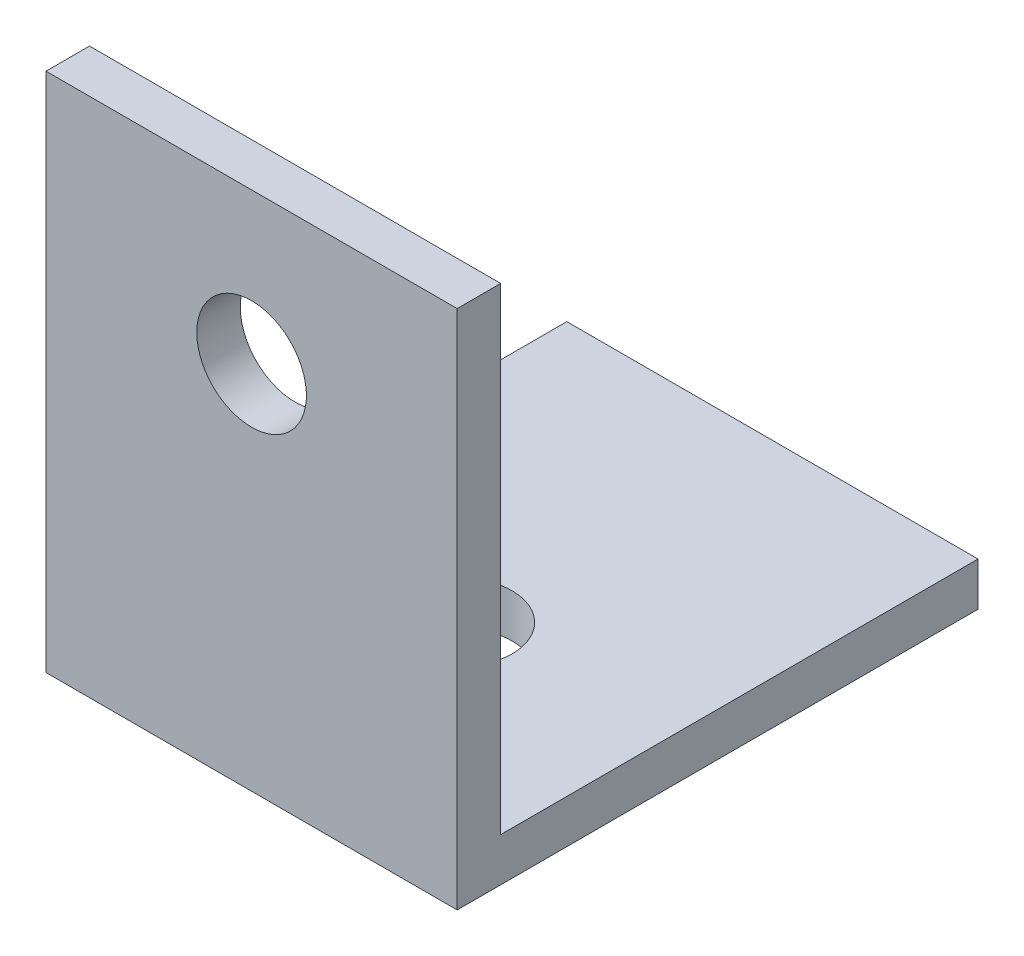
from build123d import *

# Parameters (mm, degrees)
SKETCH1_W           = 30
SKETCH1_H           = 38
BOSS_EXTRUDE1_DEPTH = 3.175
SKETCH2_W           = 30
SKETCH2_H           = 3.175
BOSS_EXTRUDE2_DEPTH = 34.825
SKETCH3_R           = 4
CUT_EXTRUDE1_DEPTH  = 60.638751035
SKETCH4_R           = 4
CUT_EXTRUDE2_DEPTH  = 58.667679423


with BuildPart() as part:
    # Sketch1 → Boss-Extrude1 (new body)
    with BuildSketch(Plane.XY):
        with Locations((15, 19)):
            Rectangle(SKETCH1_W, SKETCH1_H)
    extrude(amount=BOSS_EXTRUDE1_DEPTH)

    # Sketch2 → Boss-Extrude2 (add)
    with BuildSketch(Plane(origin=(0, 0, 0), x_dir=(-1, 0, 0), z_dir=(0, 0, -1))):
        with Locations((-15, 1.5875)):
            Rectangle(SKETCH2_W, SKETCH2_H)
    extrude(amount=BOSS_EXTRUDE2_DEPTH)

    # Sketch3 → Cut-Extrude1 (cut, through all)
    with BuildSketch(Plane(origin=(0, 0, 0), x_dir=(-1, 0, 0), z_dir=(0, 0, -1))):
        with Locations((-15, 27)):
            Circle(SKETCH3_R)
    extrude(amount=-CUT_EXTRUDE1_DEPTH, mode=Mode.SUBTRACT)

    # Sketch4 → Cut-Extrude2 (cut, through all)
    with BuildSketch(Plane(origin=(0, 3.175, 0), x_dir=(1, 0, 0), z_dir=(0, 1, 0))):
        with Locations(Location((15, 11.825, 0), (0, 0, 180))):
            Circle(SKETCH4_R)
    extrude(amount=-CUT_EXTRUDE2_DEPTH, mode=Mode.SUBTRACT)


solid = part.part
